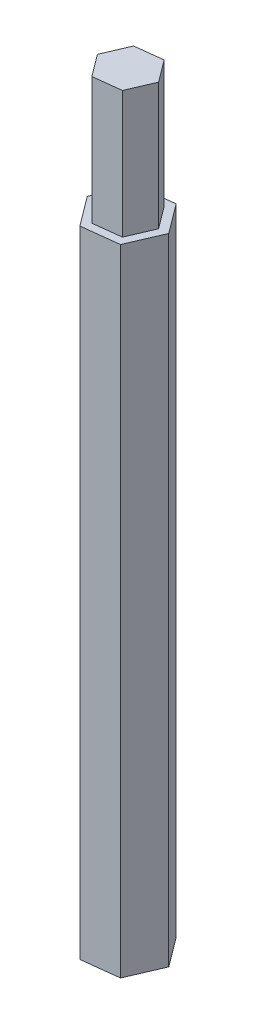
from build123d import *

# Parameters (mm, degrees)
BOSS_EXTRUDE1_DEPTH = 127
BOSS_EXTRUDE2_DEPTH = 25.4


with BuildPart() as part:
    # Sketch1 → Boss-Extrude1 (new body)
    with BuildSketch(Plane(origin=(0, 0, 0), x_dir=(1, 0, 0), z_dir=(0, 1, 0))):
        Polygon((4.386156615, -5.875794711), (7.281665794, 0.860625698), (2.895509179, 6.736420409), (-4.386156615, 5.875794711), (-7.281665794, -0.860625698), (-2.895509179, -6.736420409), align=None)
    extrude(amount=BOSS_EXTRUDE1_DEPTH)

    # Sketch2 → Boss-Extrude2 (add)
    with BuildSketch(Plane(origin=(0, 127, 0), x_dir=(1, 0, 0), z_dir=(0, 1, 0))):
        Polygon((5.461249346, 0.645469274), (2.171631885, 5.052315307), (-3.289617461, 4.406846033), (-5.461249346, -0.645469274), (-2.171631885, -5.052315307), (3.289617461, -4.406846033), align=None)
    extrude(amount=BOSS_EXTRUDE2_DEPTH)


solid = part.part
